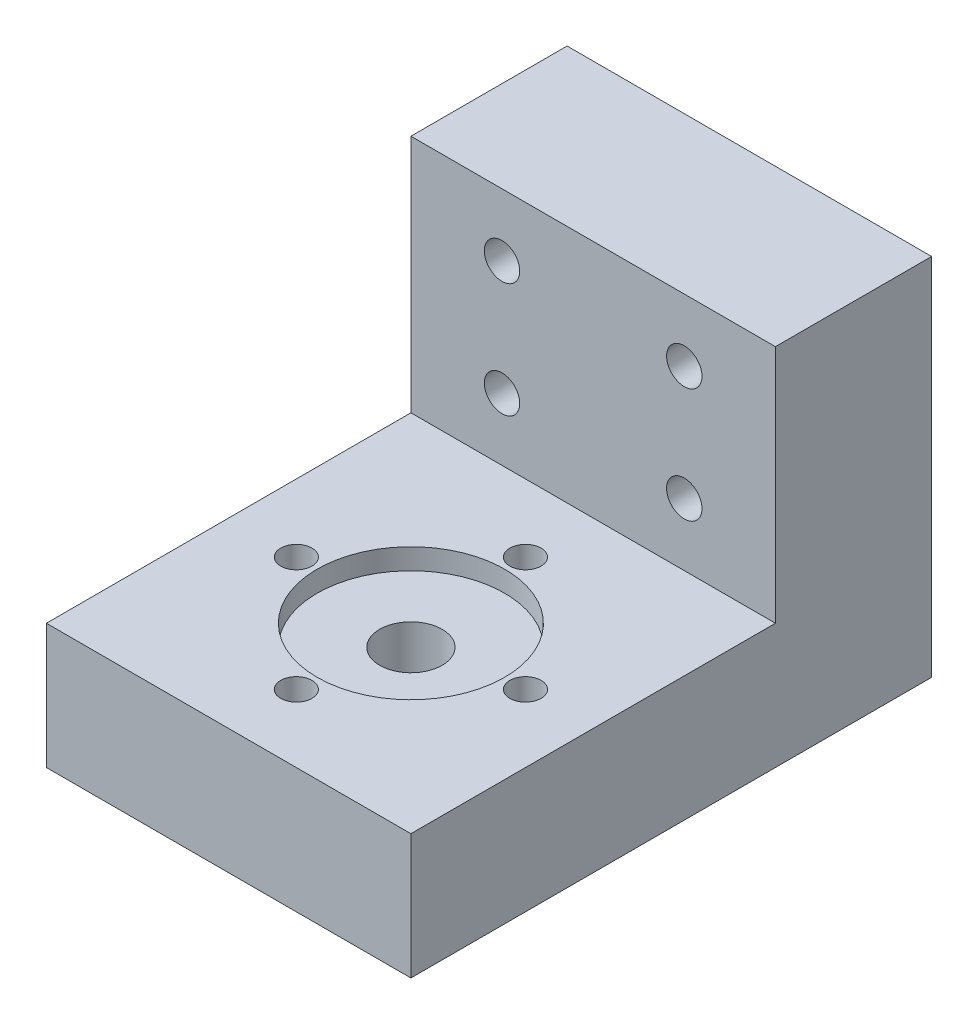
from build123d import *

# Parameters (mm, degrees)
SKETCH2_W           = 35
SKETCH2_H           = 35
BOSS_EXTRUDE1_DEPTH = 15
SKETCH3_W           = 35
SKETCH3_H           = 12
BOSS_EXTRUDE2_DEPTH = 35
SKETCH4_R           = 9
CUT_EXTRUDE1_DEPTH  = 2
SKETCH5_R           = 3
CUT_EXTRUDE2_DEPTH  = 14
SKETCH6_R           = 1.5
CUT_EXTRUDE3_DEPTH  = 58.751623354
SKETCH8_R           = 1.7
CUT_EXTRUDE4_DEPTH  = 43.866070499


with BuildPart() as part:
    # Sketch2 → Boss-Extrude1 (new body)
    with BuildSketch(Plane.XY):
        Rectangle(SKETCH2_W, SKETCH2_H)
    extrude(amount=BOSS_EXTRUDE1_DEPTH)

    # Sketch3 → Boss-Extrude2 (add)
    with BuildSketch(Plane.XY.offset(15)):
        with Locations((0, -11.5)):
            Rectangle(SKETCH3_W, SKETCH3_H)
    extrude(amount=BOSS_EXTRUDE2_DEPTH)

    # Sketch4 → Cut-Extrude1 (cut)
    with BuildSketch(Plane(origin=(0, -5.5, 0), x_dir=(1, 0, 0), z_dir=(0, 1, 0))):
        with Locations(Location((0, -32.5, 0), (0, 0, 270))):
            Circle(SKETCH4_R)
    extrude(amount=-CUT_EXTRUDE1_DEPTH, mode=Mode.SUBTRACT)

    # Sketch5 → Cut-Extrude2 (cut)
    with BuildSketch(Plane(origin=(0, -7.5, 0), x_dir=(1, 0, 0), z_dir=(0, 1, 0))):
        with Locations(Location((0, -32.5, 0), (0, 0, 270))):
            Circle(SKETCH5_R)
    extrude(amount=-CUT_EXTRUDE2_DEPTH, mode=Mode.SUBTRACT)

    # Sketch6 → Cut-Extrude3 (cut, through all)
    with BuildSketch(Plane(origin=(0, -5.5, 0), x_dir=(1, 0, 0), z_dir=(0, 1, 0))):
        with Locations(Location((0, -21.5, 0), (0, 0, 270))):
            Circle(SKETCH6_R)
        with Locations(Location((0, -43.5, 0), (0, 0, 90))):
            Circle(SKETCH6_R)
        with Locations(Location((-11, -32.5, 0), (0, 0, 270))):
            Circle(SKETCH6_R)
        with Locations(Location((11, -32.5, 0), (0, 0, 270))):
            Circle(SKETCH6_R)
    extrude(amount=-CUT_EXTRUDE3_DEPTH, mode=Mode.SUBTRACT)

    # Sketch8 → Cut-Extrude4 (cut, through all)
    with BuildSketch(Plane.XY.offset(15)):
        with Locations((-8.75, 0.5)):
            Circle(SKETCH8_R)
        with Locations((8.75, 0.5)):
            Circle(SKETCH8_R)
        with Locations((8.75, 11.5)):
            Circle(SKETCH8_R)
        with Locations((-8.75, 11.5)):
            Circle(SKETCH8_R)
    extrude(amount=-CUT_EXTRUDE4_DEPTH, mode=Mode.SUBTRACT)


solid = part.part
